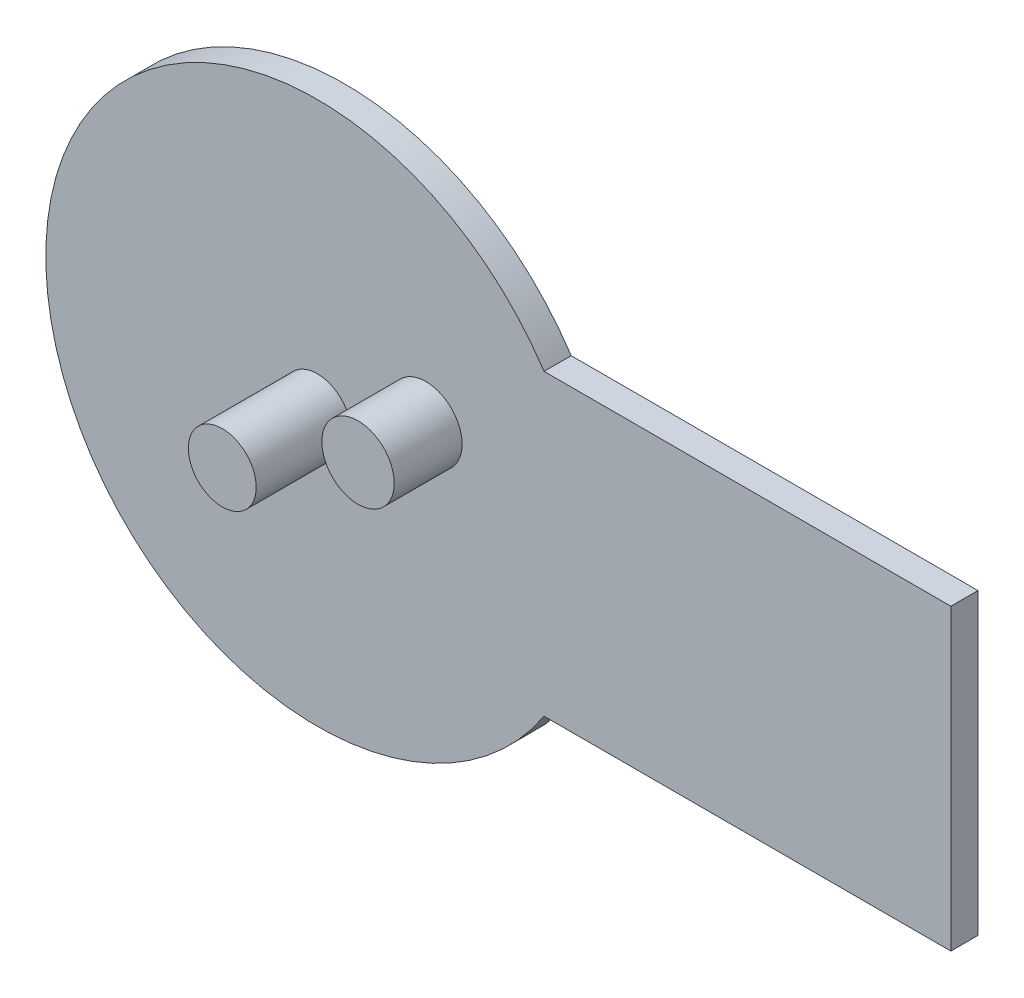
from build123d import *

# Parameters (mm, degrees)
SKETCH1_R           = 30
BOSS_EXTRUDE1_DEPTH = 3
SKETCH2_R           = 3.75
BOSS_EXTRUDE2_DEPTH = 10.5
SKETCH3_R           = 4
BOSS_EXTRUDE3_DEPTH = 7.5
BOSS_EXTRUDE4_START = -3
BOSS_EXTRUDE4_DEPTH = 3


with BuildPart() as part:
    # Sketch1 → Boss-Extrude1 (new body)
    with BuildSketch(Plane.XY):
        Circle(SKETCH1_R)
    extrude(amount=BOSS_EXTRUDE1_DEPTH)

    # Sketch2 → Boss-Extrude2 (add)
    with BuildSketch(Plane.XY.offset(3)):
        with Locations(Location((0, 0, 0), (0, 0, 180))):
            Circle(SKETCH2_R)
    extrude(amount=BOSS_EXTRUDE2_DEPTH)

    # Sketch3 → Boss-Extrude3 (add)
    with BuildSketch(Plane.XY.offset(3)):
        with Locations((12, 5)):
            Circle(SKETCH3_R)
    extrude(amount=BOSS_EXTRUDE3_DEPTH)

    # Sketch4 → Boss-Extrude4 (add)
    with BuildSketch(Plane.XY.offset(3).offset(BOSS_EXTRUDE4_START)):
        with BuildLine():
            Line((25.054939633, 16.5), (70, 16.5))
            Line((70, 16.5), (70, -16.5))
            Line((70, -16.5), (25.054939633, -16.5))
            ThreePointArc((25.054939633, -16.5), (30, 0), (25.054939633, 16.5))
        make_face()
    extrude(amount=BOSS_EXTRUDE4_DEPTH)


solid = part.part
